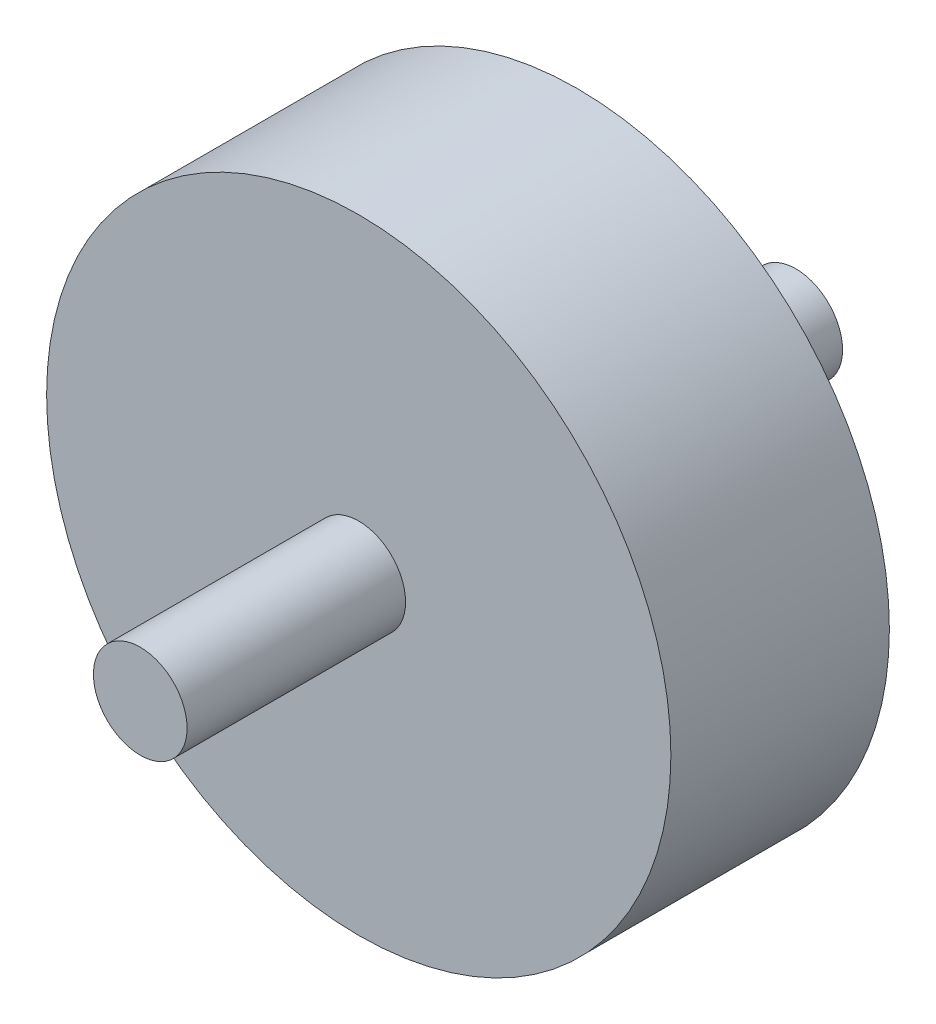
from build123d import *

# Parameters (mm, degrees)
SKETCH1_R                = 50
BOSS_EXTRUDE3_DEPTH      = 35
BOSS_EXTRUDE4_DEPTH      = 35
BOSS_EXTRUDE4_DEPTH_BACK = 70
SKETCH3_R                = 7.5


with BuildPart() as part:
    # Sketch1 → Boss-Extrude3 (new body)
    with BuildSketch(Plane.XY):
        Circle(SKETCH1_R)
    extrude(amount=BOSS_EXTRUDE3_DEPTH)

    # Sketch3 → Boss-Extrude4 (add, two sides: drawn at the far end of the back side and taken through both)
    with BuildSketch(Plane.XY.offset(35).offset(-BOSS_EXTRUDE4_DEPTH_BACK)):
        Circle(SKETCH3_R)
    extrude(amount=BOSS_EXTRUDE4_DEPTH + BOSS_EXTRUDE4_DEPTH_BACK)


solid = part.part
